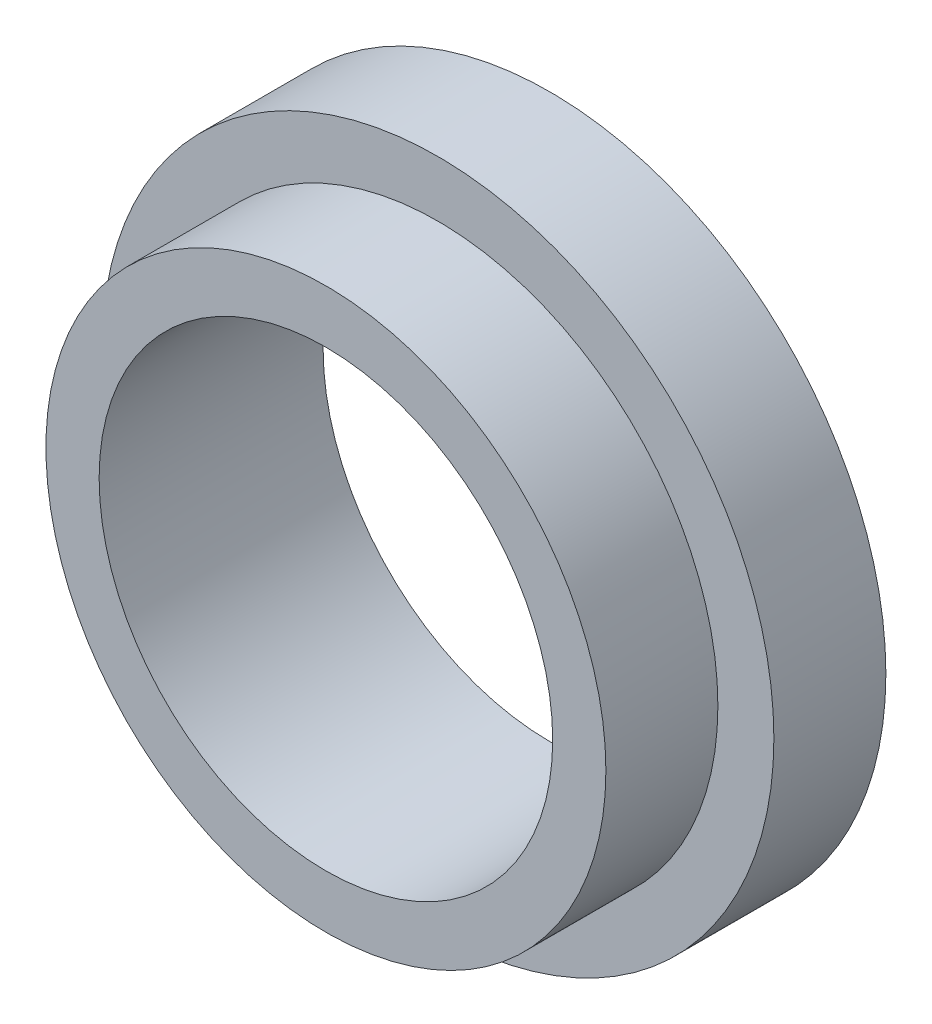
from build123d import *


with BuildPart() as part:
    # Sketch1 → Revolve1 (revolve)
    with BuildSketch(Plane(origin=(0, 0, 0), x_dir=(0, 0, -1), z_dir=(1, 0, 0)), mode=Mode.PRIVATE) as revolve1_sk:
        Polygon((0, 4.05), (4, 4.05), (4, 6), (2, 6), (2, 5), (0, 5), align=None)
    revolve(revolve1_sk.sketch.rotate(Axis((0, 0, 0), (0, 0, -1)), 90), axis=Axis((0, 0, 0), (0, 0, -1)))


solid = part.part
